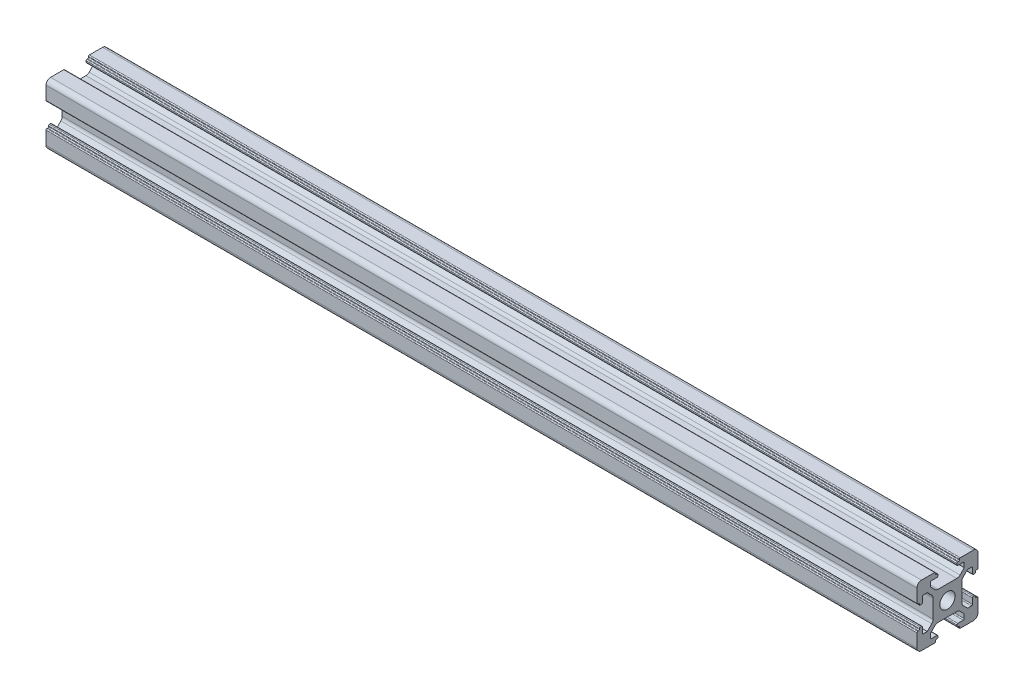
from build123d import *

# Parameters (mm, degrees)
SKETCH1_R           = 2.5
BOSS_EXTRUDE2_DEPTH = 142.5


with BuildPart() as part:
    # Sketch1 → Boss-Extrude2 (new, symmetric)
    with BuildSketch(Plane(origin=(0, 0, 0), x_dir=(0, 0, -1), z_dir=(1, 0, 0))):
        with BuildLine():
            Line((10, 4.2), (10, 8.5))
            ThreePointArc((10, 8.5), (9.560660172, 9.560660172), (8.5, 10))
            Line((8.5, 10), (4.2, 10))
            ThreePointArc((4.2, 10), (3.987867966, 9.912132034), (3.9, 9.7))
            Line((3.9, 9.7), (3.9, 9.5))
            ThreePointArc((3.9, 9.5), (3.812132034, 9.287867966), (3.6, 9.2))
            Line((3.6, 9.2), (3.4, 9.2))
            ThreePointArc((3.4, 9.2), (3.187867966, 9.112132034), (3.1, 8.9))
            Line((3.1, 8.9), (3.1, 8.5))
            ThreePointArc((3.1, 8.5), (3.187867966, 8.287867966), (3.4, 8.2))
            Line((3.4, 8.2), (5.2, 8.2))
            ThreePointArc((5.2, 8.2), (5.412132034, 8.112132034), (5.5, 7.9))
            Line((5.5, 7.9), (5.5, 6.521320344))
            Line((5.5, 6.521320344), (4.118019485, 5.139339828))
            ThreePointArc((4.118019485, 5.139339828), (3.631384461, 4.814180701), (3.057359313, 4.7))
            Line((3.057359313, 4.7), (-3.057359313, 4.7))
            ThreePointArc((-3.057359313, 4.7), (-3.631384461, 4.814180701), (-4.118019485, 5.139339828))
            Line((-4.118019485, 5.139339828), (-5.5, 6.521320344))
            Line((-5.5, 6.521320344), (-5.5, 7.9))
            ThreePointArc((-5.5, 7.9), (-5.412132034, 8.112132034), (-5.2, 8.2))
            Line((-5.2, 8.2), (-3.4, 8.2))
            ThreePointArc((-3.4, 8.2), (-3.187867966, 8.287867966), (-3.1, 8.5))
            Line((-3.1, 8.5), (-3.1, 8.9))
            ThreePointArc((-3.1, 8.9), (-3.187867966, 9.112132034), (-3.4, 9.2))
            Line((-3.4, 9.2), (-3.6, 9.2))
            ThreePointArc((-3.6, 9.2), (-3.812132034, 9.287867966), (-3.9, 9.5))
            Line((-3.9, 9.5), (-3.9, 9.7))
            ThreePointArc((-3.9, 9.7), (-3.987867966, 9.912132034), (-4.2, 10))
            Line((-4.2, 10), (-8.5, 10))
            ThreePointArc((-8.5, 10), (-9.560660172, 9.560660172), (-10, 8.5))
            Line((-10, 8.5), (-10, 4.2))
            ThreePointArc((-10, 4.2), (-9.912132034, 3.987867966), (-9.7, 3.9))
            Line((-9.7, 3.9), (-9.5, 3.9))
            ThreePointArc((-9.5, 3.9), (-9.287867966, 3.812132034), (-9.2, 3.6))
            Line((-9.2, 3.6), (-9.2, 3.4))
            ThreePointArc((-9.2, 3.4), (-9.112132034, 3.187867966), (-8.9, 3.1))
            Line((-8.9, 3.1), (-8.5, 3.1))
            ThreePointArc((-8.5, 3.1), (-8.287867966, 3.187867966), (-8.2, 3.4))
            Line((-8.2, 3.4), (-8.2, 5.2))
            ThreePointArc((-8.2, 5.2), (-8.112132034, 5.412132034), (-7.9, 5.5))
            Line((-7.9, 5.5), (-6.6, 5.5))
            Line((-6.6, 5.5), (-5.139339828, 4.039339828))
            ThreePointArc((-5.139339828, 4.039339828), (-4.814180701, 3.552704805), (-4.7, 2.978679656))
            Line((-4.7, 2.978679656), (-4.7, -2.978679656))
            ThreePointArc((-4.7, -2.978679656), (-4.814180701, -3.552704805), (-5.139339828, -4.039339828))
            Line((-5.139339828, -4.039339828), (-6.6, -5.5))
            Line((-6.6, -5.5), (-7.9, -5.5))
            ThreePointArc((-7.9, -5.5), (-8.112132034, -5.412132034), (-8.2, -5.2))
            Line((-8.2, -5.2), (-8.2, -3.4))
            ThreePointArc((-8.2, -3.4), (-8.287867966, -3.187867966), (-8.5, -3.1))
            Line((-8.5, -3.1), (-8.9, -3.1))
            ThreePointArc((-8.9, -3.1), (-9.112132034, -3.187867966), (-9.2, -3.4))
            Line((-9.2, -3.4), (-9.2, -3.6))
            ThreePointArc((-9.2, -3.6), (-9.287867966, -3.812132034), (-9.5, -3.9))
            Line((-9.5, -3.9), (-9.7, -3.9))
            ThreePointArc((-9.7, -3.9), (-9.912132034, -3.987867966), (-10, -4.2))
            Line((-10, -4.2), (-10, -8.5))
            ThreePointArc((-10, -8.5), (-9.560660172, -9.560660172), (-8.5, -10))
            Line((-8.5, -10), (-4.2, -10))
            ThreePointArc((-4.2, -10), (-3.987867966, -9.912132034), (-3.9, -9.7))
            Line((-3.9, -9.7), (-3.9, -9.5))
            ThreePointArc((-3.9, -9.5), (-3.812132034, -9.287867966), (-3.6, -9.2))
            Line((-3.6, -9.2), (-3.4, -9.2))
            ThreePointArc((-3.4, -9.2), (-3.187867966, -9.112132034), (-3.1, -8.9))
            Line((-3.1, -8.9), (-3.1, -8.5))
            ThreePointArc((-3.1, -8.5), (-3.187867966, -8.287867966), (-3.4, -8.2))
            Line((-3.4, -8.2), (-5.2, -8.2))
            ThreePointArc((-5.2, -8.2), (-5.412132034, -8.112132034), (-5.5, -7.9))
            Line((-5.5, -7.9), (-5.5, -6.521320344))
            Line((-5.5, -6.521320344), (-4.118019485, -5.139339828))
            ThreePointArc((-4.118019485, -5.139339828), (-3.631384461, -4.814180701), (-3.057359313, -4.7))
            Line((-3.057359313, -4.7), (3.057359313, -4.7))
            ThreePointArc((3.057359313, -4.7), (3.631384461, -4.814180701), (4.118019485, -5.139339828))
            Line((4.118019485, -5.139339828), (5.5, -6.521320344))
            Line((5.5, -6.521320344), (5.5, -7.9))
            ThreePointArc((5.5, -7.9), (5.412132034, -8.112132034), (5.2, -8.2))
            Line((5.2, -8.2), (3.4, -8.2))
            ThreePointArc((3.4, -8.2), (3.187867966, -8.287867966), (3.1, -8.5))
            Line((3.1, -8.5), (3.1, -8.9))
            ThreePointArc((3.1, -8.9), (3.187867966, -9.112132034), (3.4, -9.2))
            Line((3.4, -9.2), (3.6, -9.2))
            ThreePointArc((3.6, -9.2), (3.812132034, -9.287867966), (3.9, -9.5))
            Line((3.9, -9.5), (3.9, -9.7))
            ThreePointArc((3.9, -9.7), (3.987867966, -9.912132034), (4.2, -10))
            Line((4.2, -10), (8.5, -10))
            ThreePointArc((8.5, -10), (9.560660172, -9.560660172), (10, -8.5))
            Line((10, -8.5), (10, -4.2))
            ThreePointArc((10, -4.2), (9.912132034, -3.987867966), (9.7, -3.9))
            Line((9.7, -3.9), (9.5, -3.9))
            ThreePointArc((9.5, -3.9), (9.287867966, -3.812132034), (9.2, -3.6))
            Line((9.2, -3.6), (9.2, -3.4))
            ThreePointArc((9.2, -3.4), (9.112132034, -3.187867966), (8.9, -3.1))
            Line((8.9, -3.1), (8.5, -3.1))
            ThreePointArc((8.5, -3.1), (8.287867966, -3.187867966), (8.2, -3.4))
            Line((8.2, -3.4), (8.2, -5.2))
            ThreePointArc((8.2, -5.2), (8.112132034, -5.412132034), (7.9, -5.5))
            Line((7.9, -5.5), (6.6, -5.5))
            Line((6.6, -5.5), (5.139339828, -4.039339828))
            ThreePointArc((5.139339828, -4.039339828), (4.814180701, -3.552704805), (4.7, -2.978679656))
            Line((4.7, -2.978679656), (4.7, 2.978679656))
            ThreePointArc((4.7, 2.978679656), (4.814180701, 3.552704805), (5.139339828, 4.039339828))
            Line((5.139339828, 4.039339828), (6.6, 5.5))
            Line((6.6, 5.5), (7.9, 5.5))
            ThreePointArc((7.9, 5.5), (8.112132034, 5.412132034), (8.2, 5.2))
            Line((8.2, 5.2), (8.2, 3.4))
            ThreePointArc((8.2, 3.4), (8.287867966, 3.187867966), (8.5, 3.1))
            Line((8.5, 3.1), (8.9, 3.1))
            ThreePointArc((8.9, 3.1), (9.112132034, 3.187867966), (9.2, 3.4))
            Line((9.2, 3.4), (9.2, 3.6))
            ThreePointArc((9.2, 3.6), (9.287867966, 3.812132034), (9.5, 3.9))
            Line((9.5, 3.9), (9.7, 3.9))
            ThreePointArc((9.7, 3.9), (9.912132034, 3.987867966), (10, 4.2))
        make_face()
        Circle(SKETCH1_R, mode=Mode.SUBTRACT)
    extrude(amount=BOSS_EXTRUDE2_DEPTH, both=True)


solid = part.part
